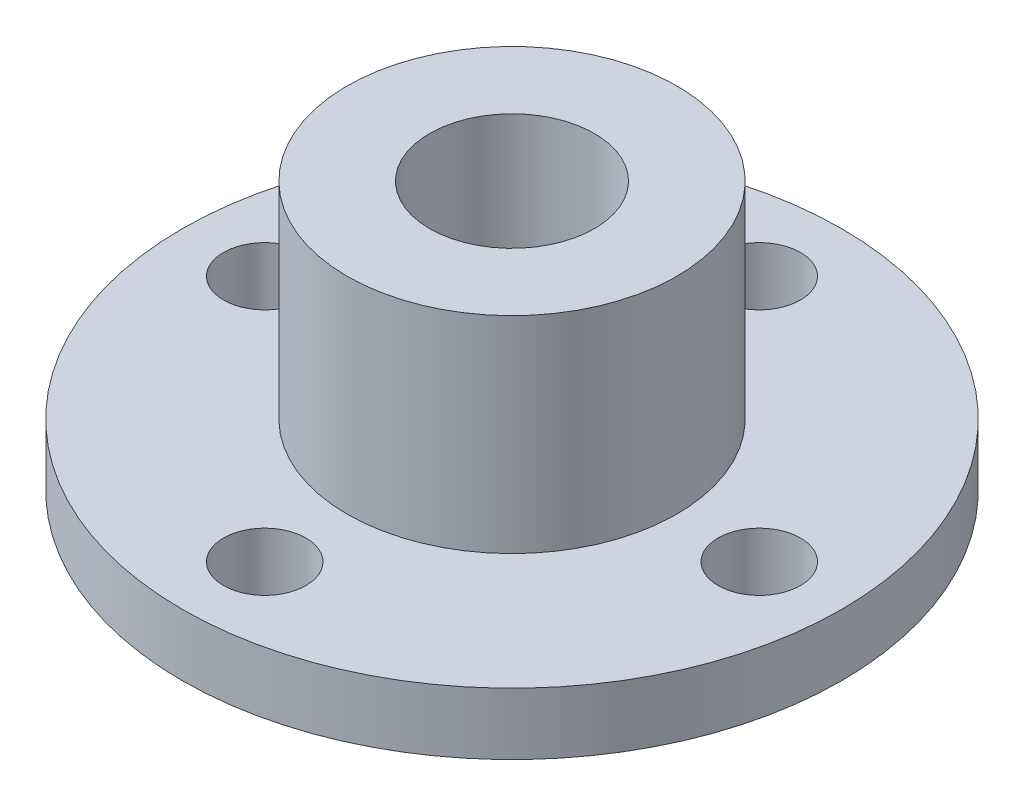
from build123d import *

# Parameters (mm, degrees)
SKETCH_1_R          = 16
SKETCH_1_R_2        = 2
EXTRUDE_1_DEPTH     = 3
SKETCH_2_R          = 8
EXTRUDE_2_DEPTH     = 10
SKETCH_3_R          = 4
CUT_EXTRUDE_1_DEPTH = 27.095976701


with BuildPart() as part:
    # 草图1 → 凸台-拉伸1 (new body)
    with BuildSketch(Plane(origin=(0, 0, 0), x_dir=(1, 0, 0), z_dir=(0, 1, 0))):
        with Locations(Location((0, 0, 0), (0, 0, 270))):
            Circle(SKETCH_1_R)
        with Locations(Location((0, 12, 0), (0, 0, 270))):
            Circle(SKETCH_1_R_2, mode=Mode.SUBTRACT)
        with Locations(Location((12, 0, 0), (0, 0, 270))):
            Circle(SKETCH_1_R_2, mode=Mode.SUBTRACT)
        with Locations(Location((0, -12, 0), (0, 0, 270))):
            Circle(SKETCH_1_R_2, mode=Mode.SUBTRACT)
        with Locations(Location((-12, 0, 0), (0, 0, 270))):
            Circle(SKETCH_1_R_2, mode=Mode.SUBTRACT)
    extrude(amount=EXTRUDE_1_DEPTH)

    # 草图2 → 凸台-拉伸2 (add)
    with BuildSketch(Plane(origin=(0, 3, 0), x_dir=(1, 0, 0), z_dir=(0, 1, 0))):
        with Locations(Location((0, 0, 0), (0, 0, 270))):
            Circle(SKETCH_2_R)
    extrude(amount=EXTRUDE_2_DEPTH)

    # 草图3 → 切除-拉伸1 (cut, through all)
    with BuildSketch(Plane(origin=(0, 13, 0), x_dir=(1, 0, 0), z_dir=(0, 1, 0))):
        with Locations(Location((0, 0, 0), (0, 0, 270))):
            Circle(SKETCH_3_R)
    extrude(amount=-CUT_EXTRUDE_1_DEPTH, mode=Mode.SUBTRACT)


solid = part.part
